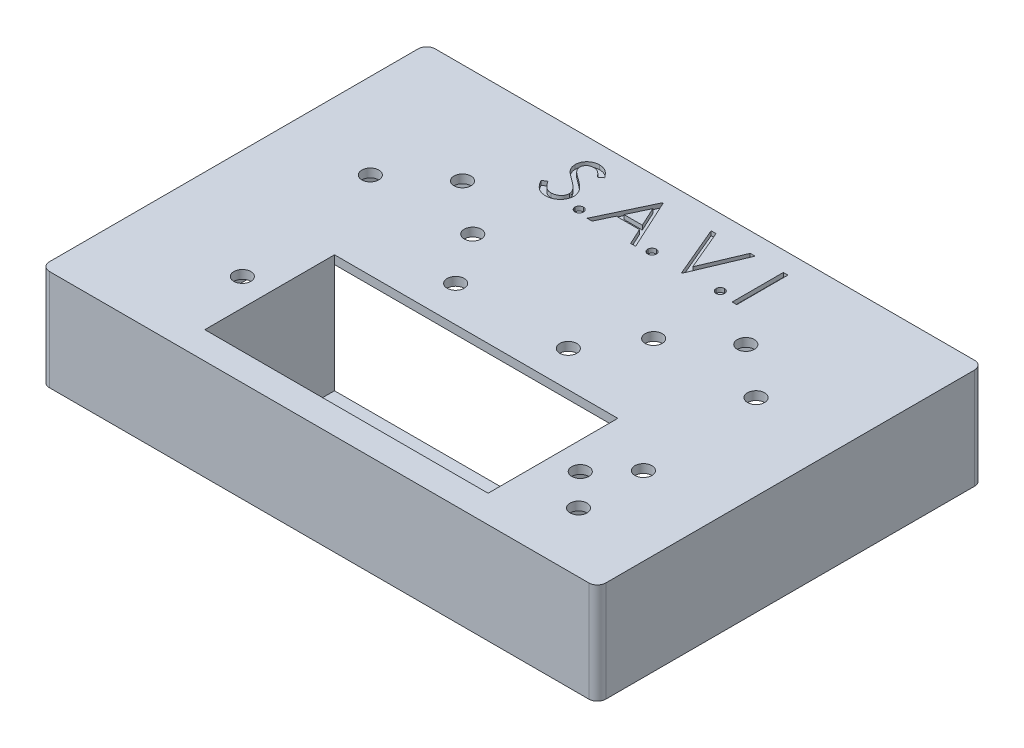
from build123d import *

# Parameters (mm, degrees)
SKETCH1_W           = 163
SKETCH1_H           = 113
BOSS_EXTRUDE1_DEPTH = 29.5
FILLET1_R           = 2.5
SKETCH2_W           = 155
SKETCH2_H           = 105
CUT_EXTRUDE1_DEPTH  = 27
SKETCH3_W           = 91
SKETCH3_H           = 38
BOSS_EXTRUDE4_DEPTH = 35
SKETCH6_W           = 83
SKETCH6_H           = 32
CUT_EXTRUDE2_DEPTH  = 39
SKETCH7_W           = 83
SKETCH7_H           = 38
CUT_EXTRUDE3_DEPTH  = 3
SKETCH8_R           = 2.5
CUT_EXTRUDE5_DEPTH  = 2.5
SKETCH9_W           = 1.346153846
SKETCH9_H           = 15
CUT_EXTRUDE6_DEPTH  = 1.25
CUT_EXTRUDE7_DEPTH  = 3


with BuildPart() as part:
    # Sketch1 → Boss-Extrude1 (new body)
    with BuildSketch(Plane(origin=(0, 0, 0), x_dir=(1, 0, 0), z_dir=(0, 1, 0))):
        Rectangle(SKETCH1_W, SKETCH1_H)
    extrude(amount=BOSS_EXTRUDE1_DEPTH)

    # Fillet1
    fillet1_edges = [part.edges().sort_by_distance(p)[0] for p in [
        (81.5, 14.75, 56.5),
        (-81.5, 14.75, 56.5),
        (-81.5, 14.75, -56.5),
        (81.5, 14.75, -56.5),
    ]]
    fillet(fillet1_edges, radius=FILLET1_R)

    # Sketch2 → Cut-Extrude1 (cut)
    with BuildSketch(Plane.XZ):
        Rectangle(SKETCH2_W, SKETCH2_H)
    extrude(amount=-CUT_EXTRUDE1_DEPTH, mode=Mode.SUBTRACT)

    # Sketch3 → Boss-Extrude4 (add)
    with BuildSketch(Plane.XZ.offset(-27)):
        with Locations((0, 29.5)):
            Rectangle(SKETCH3_W, SKETCH3_H)
    extrude(amount=BOSS_EXTRUDE4_DEPTH)

    # Sketch6 → Cut-Extrude2 (cut)
    with BuildSketch(Plane(origin=(0, 0, 10.5), x_dir=(-1, 0, 0), z_dir=(0, 0, -1))):
        with Locations((0, 11)):
            Rectangle(SKETCH6_W, SKETCH6_H)
    extrude(amount=-CUT_EXTRUDE2_DEPTH, mode=Mode.SUBTRACT)

    # Sketch7 → Cut-Extrude3 (cut)
    with BuildSketch(Plane.XZ.offset(-27)):
        with Locations((0, 29.5)):
            Rectangle(SKETCH7_W, SKETCH7_H)
    extrude(amount=-CUT_EXTRUDE3_DEPTH, mode=Mode.SUBTRACT)

    # Sketch8 → Cut-Extrude5 (cut)
    with BuildSketch(Plane(origin=(0, 29.5, 0), x_dir=(1, 0, 0), z_dir=(0, 1, 0))):
        with Locations(Location((-49.5, -29.5, 0), (0, 0, 270))):
            Circle(SKETCH8_R)
        with Locations(Location((49.5, -29.5, 0), (0, 0, 270))):
            Circle(SKETCH8_R)
        with Locations(Location((58.5, -20, 0), (0, 0, 270))):
            Circle(SKETCH8_R)
        with Locations(Location((58.5, -39, 0), (0, 0, 270))):
            Circle(SKETCH8_R)
        with Locations(Location((-16.5, 0, 0), (0, 0, 270))):
            Circle(SKETCH8_R)
        with Locations(Location((16.5, 0, 0), (0, 0, 270))):
            Circle(SKETCH8_R)
        with Locations(Location((-56.5, 15, 0), (0, 0, 270))):
            Circle(SKETCH8_R)
        with Locations(Location((-41.5, 27, 0), (0, 0, 270))):
            Circle(SKETCH8_R)
        with Locations(Location((-26.5, 15, 0), (0, 0, 270))):
            Circle(SKETCH8_R)
        with Locations(Location((41.5, 27, 0), (0, 0, 270))):
            Circle(SKETCH8_R)
        with Locations(Location((26.5, 15, 0), (0, 0, 270))):
            Circle(SKETCH8_R)
        with Locations(Location((56.5, 15, 0), (0, 0, 270))):
            Circle(SKETCH8_R)
    extrude(amount=-CUT_EXTRUDE5_DEPTH, mode=Mode.SUBTRACT)

    # Sketch9 → Cut-Extrude6 (cut)
    # profile 1 of 7: a face of its own
    with BuildSketch(Plane(origin=(0, 29.5, 0), x_dir=(1, 0, 0), z_dir=(0, 1, 0))):
        with BuildLine():
            Line((-30.115384615, 38.654640412), (-28.847355769, 39.414856758))
            add(Edge.make_bspline(
                [(-28.847355769, 39.414856758), (-28.729420467, 39.217437966), (-28.503460978, 38.839191178), (-28.126526582, 38.32808529), (-27.735956963, 37.893676047), (-27.328859819, 37.538490586), (-26.907720041, 37.2588525), (-26.469788382, 37.060842935), (-26.016540622, 36.937345898), (-25.708081387, 36.922345527), (-25.554086538, 36.914856758)],
                knots=[0, 0, 0, 0, 1.272034388, 2.437168799, 3.508375237, 4.49857839, 5.41946034, 6.295179144, 7.148887113, 8, 8, 8, 8], degree=3))
            add(Edge.make_bspline(
                [(-25.554086538, 36.914856758), (-25.422571422, 36.918519641), (-25.161842395, 36.925781313), (-24.778004211, 36.995556179), (-24.405225058, 37.102751017), (-24.051188039, 37.256269295), (-23.720778263, 37.442005663), (-23.431035283, 37.666346423), (-23.18055194, 37.917515876), (-22.975655735, 38.197727253), (-22.818455584, 38.499086462), (-22.697632433, 38.808411968), (-22.630582118, 39.130562974), (-22.620481746, 39.347464958), (-22.615384615, 39.456924066)],
                knots=[0, 0, 0, 0, 1.095163259, 2.171163733, 3.241058638, 4.321873601, 5.38011039, 6.391990106, 7.366004449, 8.327778327, 9.272591725, 10.192022065, 11.087607919, 12, 12, 12, 12], degree=3))
            add(Edge.make_bspline(
                [(-22.615384615, 39.456924066), (-22.62170309, 39.581813422), (-22.634547625, 39.835695233), (-22.743111111, 40.210265174), (-22.913893598, 40.580947617), (-23.071447785, 40.810238755), (-23.153245192, 40.929279835)],
                knots=[0, 0, 0, 0, 0.938893495, 1.908633276, 2.914225137, 4, 4, 4, 4], degree=3))
            add(Edge.make_bspline(
                [(-23.153245192, 40.929279835), (-23.220404967, 41.015194794), (-23.361398514, 41.195562502), (-23.603787854, 41.464042082), (-23.888214058, 41.740978164), (-24.204943579, 42.036945551), (-24.56551396, 42.338178965), (-24.958631879, 42.659043013), (-25.394334132, 42.987335486), (-25.699903403, 43.207503624), (-25.857572115, 43.321106758)],
                knots=[0, 0, 0, 0, 0.722233717, 1.516239348, 2.393582979, 3.351407094, 4.387010283, 5.505090956, 6.712668013, 8, 8, 8, 8], degree=3))
            add(Edge.make_bspline(
                [(-25.857572115, 43.321106758), (-26.015389242, 43.433514991), (-26.31712357, 43.648430972), (-26.739088923, 43.967392189), (-27.116422336, 44.259008773), (-27.447446692, 44.526025968), (-27.732016393, 44.768479988), (-27.972373869, 44.984042584), (-28.162396257, 45.17854356), (-28.268063031, 45.304720738), (-28.315504808, 45.361371182)],
                knots=[0, 0, 0, 0, 1.452282411, 2.77665338, 3.964542531, 5.026858415, 5.96415736, 6.766646006, 7.446254459, 8, 8, 8, 8], degree=3))
            add(Edge.make_bspline(
                [(-28.315504808, 45.361371182), (-28.381815716, 45.449661339), (-28.512225016, 45.623295784), (-28.684365039, 45.894688032), (-28.830675737, 46.172502026), (-28.945371446, 46.457484303), (-29.041955241, 46.745633998), (-29.106917802, 47.040710766), (-29.147595217, 47.341390559), (-29.151760873, 47.543734133), (-29.153846154, 47.645025028)],
                knots=[0, 0, 0, 0, 1.068054152, 2.10047183, 3.106115577, 4.101338837, 5.06977816, 6.043150881, 7.020423561, 8, 8, 8, 8], degree=3))
            add(Edge.make_bspline(
                [(-29.153846154, 47.645025028), (-29.148252401, 47.803724062), (-29.137184458, 48.117730049), (-29.043582241, 48.576433608), (-28.895841268, 49.014375396), (-28.688863177, 49.427219683), (-28.422045951, 49.804216744), (-28.113277489, 50.149703117), (-27.745513977, 50.440139898), (-27.342002734, 50.693905863), (-26.900332568, 50.892531256), (-26.437514411, 51.042364029), (-25.952812673, 51.127260847), (-25.624513525, 51.139444125), (-25.457932692, 51.145625989)],
                knots=[0, 0, 0, 0, 1.005424448, 1.989358655, 2.955360095, 3.929531133, 4.905563448, 5.876582895, 6.856512386, 7.866279853, 8.892233794, 9.918561126, 10.94386622, 12, 12, 12, 12], degree=3))
            add(Edge.make_bspline(
                [(-25.457932692, 51.145625989), (-25.281172262, 51.13952934), (-24.929652184, 51.127405049), (-24.412584117, 51.021987058), (-23.914752475, 50.847555607), (-23.51428134, 50.649604216), (-23.20085522, 50.451898149), (-22.961829222, 50.271813187), (-22.719611576, 50.064491293), (-22.472248484, 49.829380239), (-22.223931372, 49.564322734), (-21.97097372, 49.271134067), (-21.712783996, 48.951605971), (-21.546687453, 48.723500967), (-21.461538462, 48.606563489)],
                knots=[0, 0, 0, 0, 1.286793592, 2.559021753, 3.825965368, 5.121522368, 5.803751409, 6.523245864, 7.299691795, 8.125521123, 9.008227632, 9.944561021, 10.946284179, 12, 12, 12, 12], degree=3))
            Line((-21.461538462, 48.606563489), (-22.678485577, 47.684087528))
            add(Edge.make_bspline(
                [(-22.678485577, 47.684087528), (-22.751968145, 47.778753344), (-22.893478389, 47.961057572), (-23.108319047, 48.21636321), (-23.310813253, 48.449576694), (-23.510314966, 48.652141528), (-23.696287672, 48.835150671), (-23.876789282, 48.991835343), (-24.049222216, 49.123730752), (-24.266580404, 49.264488866), (-24.53965634, 49.404016739), (-24.88244721, 49.522084216), (-25.240674103, 49.593034482), (-25.484658237, 49.602415428), (-25.608173077, 49.607164451)],
                knots=[0, 0, 0, 0, 1.181633172, 2.275549214, 3.290209073, 4.226197932, 5.078386478, 5.862611352, 6.581680152, 7.217281963, 8.414376989, 9.595101626, 10.782541182, 12, 12, 12, 12], degree=3))
            add(Edge.make_bspline(
                [(-25.608173077, 49.607164451), (-25.763129602, 49.601971451), (-26.061948662, 49.59195724), (-26.486192531, 49.482585875), (-26.868023638, 49.310377902), (-27.19610606, 49.069027996), (-27.469264533, 48.783080884), (-27.666859356, 48.454028648), (-27.785788633, 48.090675494), (-27.80030126, 47.837211253), (-27.807692308, 47.708125989)],
                knots=[0, 0, 0, 0, 1.14458467, 2.207223713, 3.21896685, 4.227309161, 5.202851033, 6.127160689, 7.046193047, 8, 8, 8, 8], degree=3))
            add(Edge.make_bspline(
                [(-27.807692308, 47.708125989), (-27.806007479, 47.62776251), (-27.802635067, 47.466904141), (-27.75560022, 47.22925519), (-27.695174525, 46.992206592), (-27.599420389, 46.756824094), (-27.46722623, 46.518991127), (-27.293632619, 46.274612252), (-27.075004139, 46.0215335), (-26.907531229, 45.85693047), (-26.819110577, 45.770025028)],
                knots=[0, 0, 0, 0, 0.858281714, 1.717966888, 2.583508476, 3.4729293, 4.427298488, 5.488583878, 6.674047936, 8, 8, 8, 8], degree=3))
            add(Edge.make_bspline(
                [(-26.819110577, 45.770025028), (-26.786276124, 45.740723488), (-26.708268979, 45.671109738), (-26.565657869, 45.557142821), (-26.37733159, 45.416559512), (-26.148207871, 45.24261387), (-25.874062035, 45.040836175), (-25.554863937, 44.813806408), (-25.194171654, 44.554154441), (-24.938220586, 44.372622124), (-24.802884615, 44.276635605)],
                knots=[0, 0, 0, 0, 0.420754252, 0.999615792, 1.744751191, 2.668019286, 3.750313428, 4.999500688, 6.413464383, 8, 8, 8, 8], degree=3))
            add(Edge.make_bspline(
                [(-24.802884615, 44.276635605), (-24.640087844, 44.158172635), (-24.32485446, 43.928785513), (-23.876321974, 43.584146885), (-23.469634225, 43.247085019), (-23.103363353, 42.919752417), (-22.773890888, 42.604632019), (-22.484872085, 42.297932675), (-22.233362027, 42.001851649), (-21.962593947, 41.622254896), (-21.685917578, 41.156050249), (-21.448311118, 40.584857798), (-21.298489629, 40.011444996), (-21.27889742, 39.626044268), (-21.269230769, 39.435890412)],
                knots=[0, 0, 0, 0, 1.163667725, 2.253281268, 3.268753668, 4.215851969, 5.092017293, 5.902905408, 6.650798638, 7.335211899, 8.59617414, 9.77448103, 10.901945474, 12, 12, 12, 12], degree=3))
            add(Edge.make_bspline(
                [(-21.269230769, 39.435890412), (-21.272047075, 39.301411705), (-21.277624997, 39.035065775), (-21.341743199, 38.643972589), (-21.435684621, 38.264126004), (-21.577272767, 37.900221237), (-21.750086302, 37.545600825), (-21.969370222, 37.209566966), (-22.223546013, 36.884682401), (-22.515119291, 36.579610295), (-22.834173159, 36.299555169), (-23.171388993, 36.05043062), (-23.527318734, 35.842709234), (-23.90003152, 35.673205625), (-24.289612963, 35.540633408), (-24.695932036, 35.444578254), (-25.119658513, 35.385625207), (-25.407660577, 35.37950623), (-25.554086538, 35.37639522)],
                knots=[0, 0, 0, 0, 0.983748083, 1.948392443, 2.894712957, 3.844097841, 4.80183111, 5.778335162, 6.776009319, 7.81870978, 8.863265674, 9.881300176, 10.883814829, 11.87499822, 12.874611388, 13.892143829, 14.928324115, 16, 16, 16, 16], degree=3))
            add(Edge.make_bspline(
                [(-25.554086538, 35.37639522), (-25.667380866, 35.378585998), (-25.892542694, 35.382939964), (-26.225583331, 35.421431166), (-26.551895856, 35.475890181), (-26.867385636, 35.562350481), (-27.1761174, 35.667251811), (-27.476748405, 35.796416094), (-27.769424351, 35.9512041), (-28.05578542, 36.128182777), (-28.335103311, 36.33414454), (-28.604758174, 36.574030953), (-28.87359754, 36.841225974), (-29.133686382, 37.142985532), (-29.390285571, 37.474434458), (-29.638335898, 37.838673816), (-29.882971831, 38.233719617), (-30.036466693, 38.511712842), (-30.115384615, 38.654640412)],
                knots=[0, 0, 0, 0, 0.915332311, 1.819136955, 2.706846663, 3.586547465, 4.459518054, 5.340707479, 6.227863349, 7.133153174, 8.059268498, 9.028702269, 10.047606654, 11.120612155, 12.245963614, 13.433783089, 14.680604001, 16, 16, 16, 16], degree=3))
        make_face()
    # profile 2 of 7: a face of its own
    with BuildSketch(Plane(origin=(0, 29.5, 0), x_dir=(1, 0, 0), z_dir=(0, 1, 0))):
        with BuildLine():
            add(Edge.make_bspline(
                [(-17.134615385, 38.068702912), (-17.051085904, 38.063739341), (-16.887336122, 38.054008839), (-16.650597001, 37.987251666), (-16.436334173, 37.86871455), (-16.245481696, 37.710731214), (-16.088168225, 37.519178372), (-15.965406716, 37.306624477), (-15.899231065, 37.067903366), (-15.889571443, 36.903204759), (-15.884615385, 36.818702912)],
                knots=[0, 0, 0, 0, 1.020151414, 1.999887582, 2.974338812, 3.990962822, 5.007586832, 5.987933904, 6.967670073, 8, 8, 8, 8], degree=3))
            add(Edge.make_bspline(
                [(-15.884615385, 36.818702912), (-15.889739388, 36.736231499), (-15.899843847, 36.573599083), (-15.965255025, 36.336678529), (-16.089103811, 36.123991796), (-16.244396638, 35.929839775), (-16.436381353, 35.771521758), (-16.651103552, 35.653993138), (-16.886780373, 35.582456081), (-17.050993187, 35.573343379), (-17.134615385, 35.568702912)],
                knots=[0, 0, 0, 0, 1.009421747, 1.99056486, 2.972319754, 3.999869655, 5.017953583, 5.993804169, 6.978383603, 8, 8, 8, 8], degree=3))
            add(Edge.make_bspline(
                [(-17.134615385, 35.568702912), (-17.218297837, 35.573175472), (-17.381667906, 35.581907079), (-17.616465024, 35.655461963), (-17.832494889, 35.77041965), (-18.024442225, 35.930134976), (-18.181035675, 36.122992734), (-18.299430173, 36.33814329), (-18.370530811, 36.572920879), (-18.379881694, 36.736097919), (-18.384615385, 36.818702912)],
                knots=[0, 0, 0, 0, 1.022052826, 1.995314843, 2.982371812, 4.00089066, 5.028879526, 6.005146991, 6.990147033, 8, 8, 8, 8], degree=3))
            add(Edge.make_bspline(
                [(-18.384615385, 36.818702912), (-18.380063531, 36.903343111), (-18.371176594, 37.068592711), (-18.299280908, 37.305160314), (-18.181954285, 37.520167911), (-18.023359735, 37.710438969), (-17.832541324, 37.869813123), (-17.616986159, 37.985805094), (-17.381102415, 38.054549717), (-17.218202679, 38.06390336), (-17.134615385, 38.068702912)],
                knots=[0, 0, 0, 0, 1.032775665, 2.016367738, 2.991239715, 4.008302682, 5.025365648, 6.011011707, 6.979408107, 8, 8, 8, 8], degree=3))
        make_face()
    # profile 3 of 7: a face of its own
    with BuildSketch(Plane(origin=(0, 29.5, 0), x_dir=(1, 0, 0), z_dir=(0, 1, 0))):
        Polygon((-6.461538462, 50.761010605), (0.461538462, 35.761010605), (-1.001802885, 35.761010605), (-3.219350962, 40.568702912), (-10.019230769, 40.568702912), (-12.299879808, 35.761010605), (-13.769230769, 35.761010605), (-6.653846154, 50.761010605), align=None)
        Polygon((-6.572716346, 47.83733272), (-9.2890625, 42.107164451), (-3.928485577, 42.107164451), align=None, mode=Mode.SUBTRACT)
    # profile 4 of 7: a face of its own
    with BuildSketch(Plane(origin=(0, 29.5, 0), x_dir=(1, 0, 0), z_dir=(0, 1, 0))):
        with BuildLine():
            add(Edge.make_bspline(
                [(4.211538462, 38.068702912), (4.295067942, 38.063739341), (4.458817724, 38.054008839), (4.695556845, 37.987251666), (4.909819673, 37.86871455), (5.10067215, 37.710731214), (5.257985621, 37.519178372), (5.38074713, 37.306624477), (5.446922781, 37.067903366), (5.456582403, 36.903204759), (5.461538462, 36.818702912)],
                knots=[0, 0, 0, 0, 1.020151414, 1.999887582, 2.974338812, 3.990962822, 5.007586832, 5.987933904, 6.967670073, 8, 8, 8, 8], degree=3))
            add(Edge.make_bspline(
                [(5.461538462, 36.818702912), (5.456414458, 36.736231499), (5.446309999, 36.573599083), (5.380898822, 36.336678529), (5.257050035, 36.123991796), (5.101757208, 35.929839775), (4.909772493, 35.771521758), (4.695050294, 35.653993138), (4.459373473, 35.582456081), (4.295160659, 35.573343379), (4.211538462, 35.568702912)],
                knots=[0, 0, 0, 0, 1.009421747, 1.99056486, 2.972319754, 3.999869655, 5.017953583, 5.993804169, 6.978383603, 8, 8, 8, 8], degree=3))
            add(Edge.make_bspline(
                [(4.211538462, 35.568702912), (4.127856009, 35.573175472), (3.96448594, 35.581907079), (3.729688822, 35.655461963), (3.513658957, 35.77041965), (3.321711621, 35.930134976), (3.165118171, 36.122992734), (3.046723673, 36.33814329), (2.975623035, 36.572920879), (2.966272152, 36.736097919), (2.961538462, 36.818702912)],
                knots=[0, 0, 0, 0, 1.022052826, 1.995314843, 2.982371812, 4.00089066, 5.028879526, 6.005146991, 6.990147033, 8, 8, 8, 8], degree=3))
            add(Edge.make_bspline(
                [(2.961538462, 36.818702912), (2.966090315, 36.903343111), (2.974977252, 37.068592711), (3.046872938, 37.305160314), (3.164199561, 37.520167911), (3.322794111, 37.710438969), (3.513612522, 37.869813123), (3.729167687, 37.985805094), (3.965051431, 38.054549717), (4.127951167, 38.06390336), (4.211538462, 38.068702912)],
                knots=[0, 0, 0, 0, 1.032775665, 2.016367738, 2.991239715, 4.008302682, 5.025365648, 6.011011707, 6.979408107, 8, 8, 8, 8], degree=3))
        make_face()
    # profile 5 of 7: a face of its own
    with BuildSketch(Plane(origin=(0, 29.5, 0), x_dir=(1, 0, 0), z_dir=(0, 1, 0))):
        Polygon((7.576923077, 50.761010605), (9.019230769, 50.761010605), (14.019230769, 38.940097143), (19.019230769, 50.761010605), (20.461538462, 50.761010605), (14.115384615, 35.761010605), (13.923076923, 35.761010605), align=None)
    # profile 6 of 7: a face of its own
    with BuildSketch(Plane(origin=(0, 29.5, 0), x_dir=(1, 0, 0), z_dir=(0, 1, 0))):
        with BuildLine():
            add(Edge.make_bspline(
                [(24.211538462, 38.068702912), (24.295067942, 38.063739341), (24.458817724, 38.054008839), (24.695556845, 37.987251666), (24.909819673, 37.86871455), (25.10067215, 37.710731214), (25.257985621, 37.519178372), (25.38074713, 37.306624477), (25.446922781, 37.067903366), (25.456582403, 36.903204759), (25.461538462, 36.818702912)],
                knots=[0, 0, 0, 0, 1.020151414, 1.999887582, 2.974338812, 3.990962822, 5.007586832, 5.987933904, 6.967670073, 8, 8, 8, 8], degree=3))
            add(Edge.make_bspline(
                [(25.461538462, 36.818702912), (25.456414458, 36.736231499), (25.446309999, 36.573599083), (25.380898822, 36.336678529), (25.257050035, 36.123991796), (25.101757208, 35.929839775), (24.909772493, 35.771521758), (24.695050294, 35.653993138), (24.459373473, 35.582456081), (24.295160659, 35.573343379), (24.211538462, 35.568702912)],
                knots=[0, 0, 0, 0, 1.009421747, 1.99056486, 2.972319754, 3.999869655, 5.017953583, 5.993804169, 6.978383603, 8, 8, 8, 8], degree=3))
            add(Edge.make_bspline(
                [(24.211538462, 35.568702912), (24.127856009, 35.573175472), (23.96448594, 35.581907079), (23.729688822, 35.655461963), (23.513658957, 35.77041965), (23.321711621, 35.930134976), (23.165118171, 36.122992734), (23.046723673, 36.33814329), (22.975623035, 36.572920879), (22.966272152, 36.736097919), (22.961538462, 36.818702912)],
                knots=[0, 0, 0, 0, 1.022052826, 1.995314843, 2.982371812, 4.00089066, 5.028879526, 6.005146991, 6.990147033, 8, 8, 8, 8], degree=3))
            add(Edge.make_bspline(
                [(22.961538462, 36.818702912), (22.966090315, 36.903343111), (22.974977252, 37.068592711), (23.046872938, 37.305160314), (23.164199561, 37.520167911), (23.322794111, 37.710438969), (23.513612522, 37.869813123), (23.729167687, 37.985805094), (23.965051431, 38.054549717), (24.127951167, 38.06390336), (24.211538462, 38.068702912)],
                knots=[0, 0, 0, 0, 1.032775665, 2.016367738, 2.991239715, 4.008302682, 5.025365648, 6.011011707, 6.979408107, 8, 8, 8, 8], degree=3))
        make_face()
    # profile 7 of 7: a face of its own
    with BuildSketch(Plane(origin=(0, 29.5, 0), x_dir=(1, 0, 0), z_dir=(0, 1, 0))):
        with Locations((29.403846154, 43.261010605)):
            Rectangle(SKETCH9_W, SKETCH9_H)
    extrude(amount=-CUT_EXTRUDE6_DEPTH, mode=Mode.SUBTRACT)

    # Sketch10 → Cut-Extrude7 (cut)
    with BuildSketch(Plane(origin=(0, 0, 0), x_dir=(-1, 0, 0), z_dir=(0, -1, 0))):
        with BuildLine():
            Line((61.5, -55.5), (58.5, -55.5))
            ThreePointArc((58.5, -55.5), (57.5, -54.5), (58.5, -53.5))
            Line((58.5, -53.5), (61.5, -53.5))
            ThreePointArc((61.5, -53.5), (62.5, -54.5), (61.5, -55.5))
        make_face()
        with BuildLine():
            Line((-61.5, -53.5), (-58.5, -53.5))
            ThreePointArc((-58.5, -53.5), (-57.5, -54.5), (-58.5, -55.5))
            Line((-58.5, -55.5), (-61.5, -55.5))
            ThreePointArc((-61.5, -55.5), (-62.5, -54.5), (-61.5, -53.5))
        make_face()
        with BuildLine():
            Line((61.5, 53.5), (58.5, 53.5))
            ThreePointArc((58.5, 53.5), (57.5, 54.5), (58.5, 55.5))
            Line((58.5, 55.5), (61.5, 55.5))
            ThreePointArc((61.5, 55.5), (62.5, 54.5), (61.5, 53.5))
        make_face()
        with BuildLine():
            Line((-61.5, 55.5), (-58.5, 55.5))
            ThreePointArc((-58.5, 55.5), (-57.5, 54.5), (-58.5, 53.5))
            Line((-58.5, 53.5), (-61.5, 53.5))
            ThreePointArc((-61.5, 53.5), (-62.5, 54.5), (-61.5, 55.5))
        make_face()
    extrude(amount=-CUT_EXTRUDE7_DEPTH, mode=Mode.SUBTRACT)


solid = part.part
